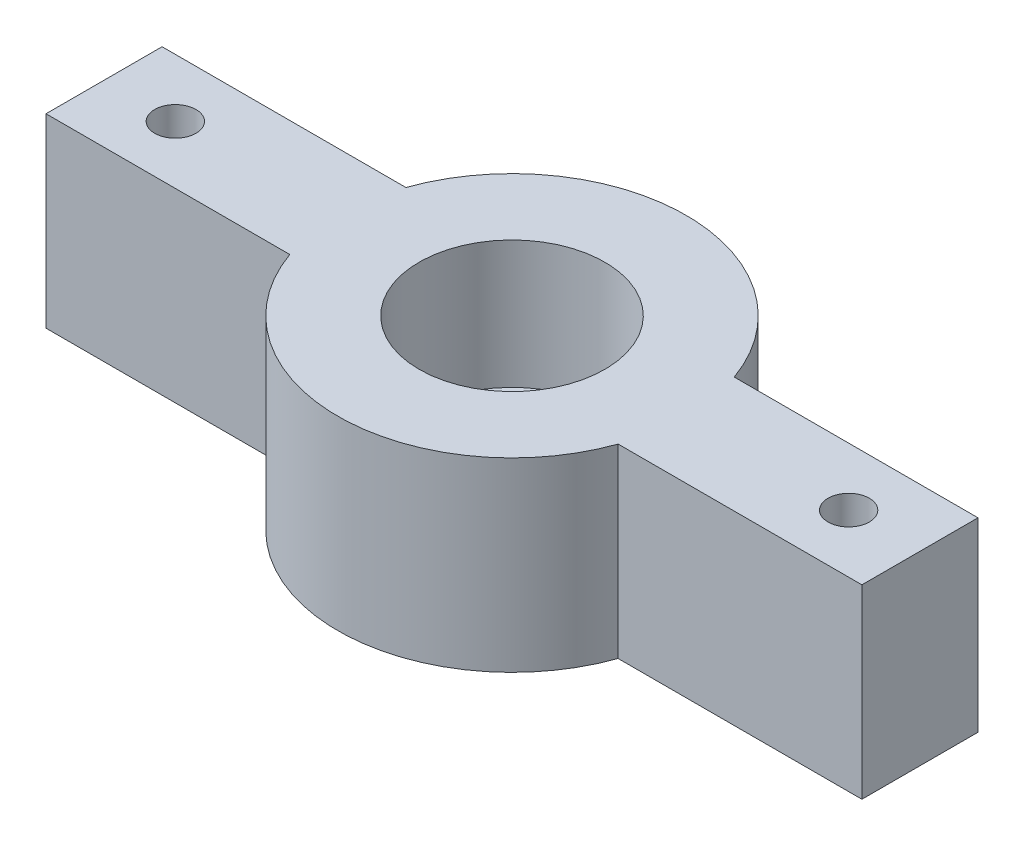
from build123d import *

# Parameters (mm, degrees)
SKETCH1_R           = 1.875
SKETCH1_R_2         = 0.889
BOSS_EXTRUDE1_DEPTH = 8
SKETCH2_R           = 4
CUT_EXTRUDE1_DEPTH  = 5.5


with BuildPart() as part:
    # Sketch1 → Boss-Extrude1 (new body)
    with BuildSketch(Plane(origin=(0, 0, 0), x_dir=(1, 0, 0), z_dir=(0, 1, 0))):
        with BuildLine():
            Line((-7.071067812, 2.5), (-17.571067812, 2.5))
            Line((-17.571067812, 2.5), (-17.571067812, -2.5))
            Line((-17.571067812, -2.5), (-7.071067812, -2.5))
            ThreePointArc((-7.071067812, -2.5), (0, -7.5), (7.071067812, -2.5))
            Line((7.071067812, -2.5), (17.571067812, -2.5))
            Line((17.571067812, -2.5), (17.571067812, 2.5))
            Line((17.571067812, 2.5), (7.071067812, 2.5))
            ThreePointArc((7.071067812, 2.5), (0, 7.5), (-7.071067812, 2.5))
        make_face()
        with Locations(Location((0, 0, 0), (0, 0, 270))):
            Circle(SKETCH1_R, mode=Mode.SUBTRACT)
        with Locations(Location((-14.5, 0, 0), (0, 0, 270))):
            Circle(SKETCH1_R_2, mode=Mode.SUBTRACT)
        with Locations(Location((14.5, 0, 0), (0, 0, 270))):
            Circle(SKETCH1_R_2, mode=Mode.SUBTRACT)
    extrude(amount=BOSS_EXTRUDE1_DEPTH)

    # Sketch2 → Cut-Extrude1 (cut)
    with BuildSketch(Plane(origin=(0, 8, 0), x_dir=(1, 0, 0), z_dir=(0, 1, 0))):
        with Locations(Location((0, 0, 0), (0, 0, 270))):
            Circle(SKETCH2_R)
    extrude(amount=-CUT_EXTRUDE1_DEPTH, mode=Mode.SUBTRACT)


solid = part.part
